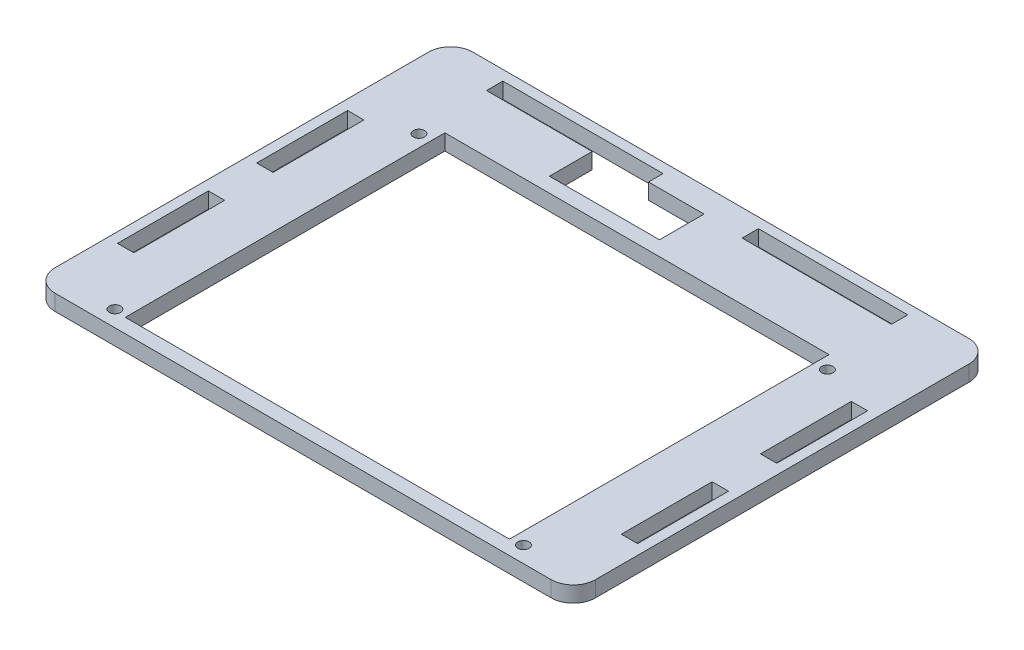
from build123d import *

# Parameters (mm, degrees)
SKETCH1_R           = 1.1303
SKETCH1_W           = 3.2766
SKETCH1_H           = 18.2372
BOSS_EXTRUDE1_DEPTH = 1.5875
FILLET1_R           = 4.445
SKETCH2_W           = 81.9912
SKETCH2_H           = 2.0955
BOSS_EXTRUDE2_DEPTH = 3.175
BOSS_EXTRUDE3_DEPTH = 3.175
SKETCH5_W           = 77.1144
SKETCH5_H           = 0.762
BOSS_EXTRUDE4_DEPTH = 3.175


with BuildPart() as part:
    # Sketch1 → Boss-Extrude1 (new, symmetric)
    with BuildSketch(Plane(origin=(0, 0, 0), x_dir=(1, 0, 0), z_dir=(0, 1, 0))):
        Polygon((-38.5572, -41.9227), (-38.5572, 25.0825), (38.5572, 25.0825), (38.5572, -41.9227), (54.229, -41.9227), (54.229, 41.9227), (-54.229, 41.9227), (-54.229, -41.9227), align=None)
        with Locations(Location((-40.9956, -38.6969, 0), (0, 0, 270))):
            Circle(SKETCH1_R, mode=Mode.SUBTRACT)
        with Locations(Location((-40.9956, 22.3139, 0), (0, 0, 270))):
            Circle(SKETCH1_R, mode=Mode.SUBTRACT)
        with Locations(Location((40.9956, 22.3139, 0), (0, 0, 270))):
            Circle(SKETCH1_R, mode=Mode.SUBTRACT)
        with Locations(Location((40.9956, -38.6969, 0), (0, 0, 270))):
            Circle(SKETCH1_R, mode=Mode.SUBTRACT)
        with Locations((-50.5587, 10.0711)):
            Rectangle(SKETCH1_W, SKETCH1_H, mode=Mode.SUBTRACT)
        with Locations((-50.5587, -17.8689)):
            Rectangle(SKETCH1_W, SKETCH1_H, mode=Mode.SUBTRACT)
        with Locations((50.5587, -17.8689)):
            Rectangle(SKETCH1_W, SKETCH1_H, mode=Mode.SUBTRACT)
        with Locations((50.5587, 10.0711)):
            Rectangle(SKETCH1_W, SKETCH1_H, mode=Mode.SUBTRACT)
        Polygon((-20.5232, 36.6141), (-41.7322, 36.6141), (-41.7322, 39.8907), (-9.5758, 39.8907), (-9.5758, 37.2237), (-9.5758, 36.9697), (1.5748, 36.9697), (1.5748, 28.0289), (-20.5232, 28.0289), align=None, mode=Mode.SUBTRACT)
        Polygon((9.5758, 38.590972839), (9.5758, 39.8907), (39.5478, 39.8907), (39.5478, 37.1221), (44.5262, 37.1221), (44.5262, 30.7721), (35.7632, 30.7721), (35.7632, 36.6141), (9.5758, 36.6141), align=None, mode=Mode.SUBTRACT)
    extrude(amount=BOSS_EXTRUDE1_DEPTH, both=True)

    # Fillet1
    fillet1_edges = [part.edges().sort_by_distance(p)[0] for p in [
        (-54.229, 0, -41.9227),
        (54.229, 0, -41.9227),
        (54.229, 0, 41.9227),
        (-54.229, 0, 41.9227),
    ]]
    fillet(fillet1_edges, radius=FILLET1_R)

    # Sketch2 → Boss-Extrude2 (add)
    with BuildSketch(Plane(origin=(0, 1.5875, 0), x_dir=(1, 0, 0), z_dir=(0, 1, 0))):
        with Locations((0, -40.87495)):
            Rectangle(SKETCH2_W, SKETCH2_H)
    extrude(amount=-BOSS_EXTRUDE2_DEPTH)

    # Sketch4 → Boss-Extrude3 (add, through all)
    with BuildSketch(Plane(origin=(0, 1.5875, 0), x_dir=(1, 0, 0), z_dir=(0, 1, 0))):
        Polygon((35.7632, 36.6141), (39.5478, 36.6141), (39.5478, 37.1221), (44.5262, 37.1221), (44.5262, 30.7721), (35.7632, 30.7721), align=None)
    extrude(amount=-BOSS_EXTRUDE3_DEPTH)

    # Sketch5 → Boss-Extrude4 (add)
    with BuildSketch(Plane(origin=(0, 1.5875, 0), x_dir=(1, 0, 0), z_dir=(0, 1, 0))):
        with Locations((0, -39.4462)):
            Rectangle(SKETCH5_W, SKETCH5_H)
    extrude(amount=-BOSS_EXTRUDE4_DEPTH)


solid = part.part
